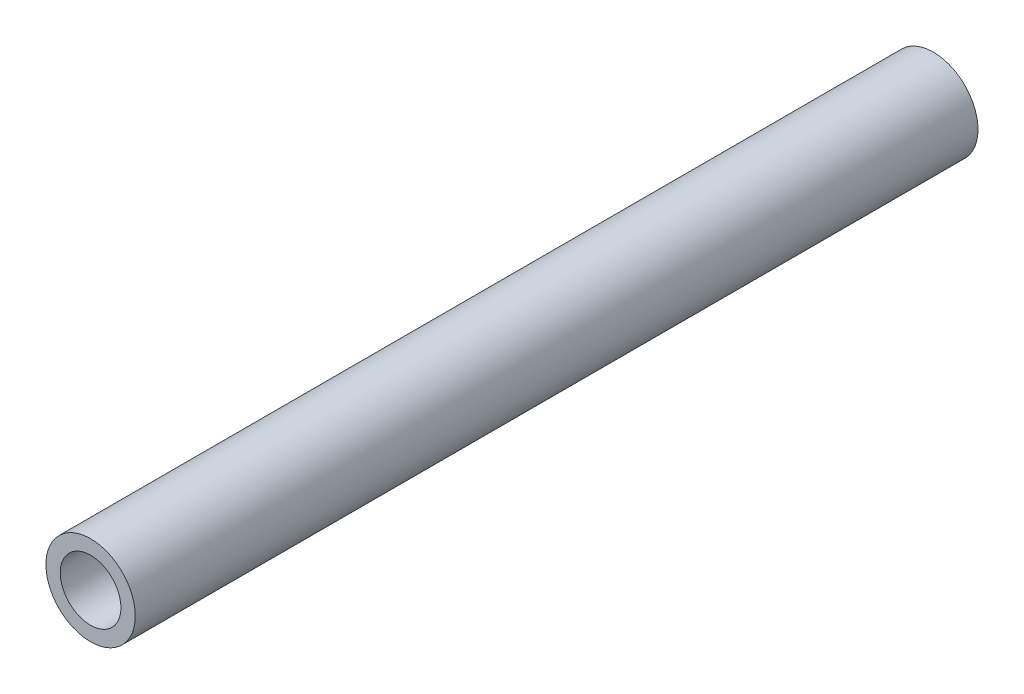
from build123d import *

# Parameters (mm, degrees)
SKETCH1_R           = 2.65
SKETCH1_R_2         = 1.8
BOSS_EXTRUDE1_DEPTH = 50


with BuildPart() as part:
    # Sketch1 → Boss-Extrude1 (new body)
    with BuildSketch(Plane.XY):
        Circle(SKETCH1_R)
        Circle(SKETCH1_R_2, mode=Mode.SUBTRACT)
    extrude(amount=BOSS_EXTRUDE1_DEPTH)


solid = part.part
